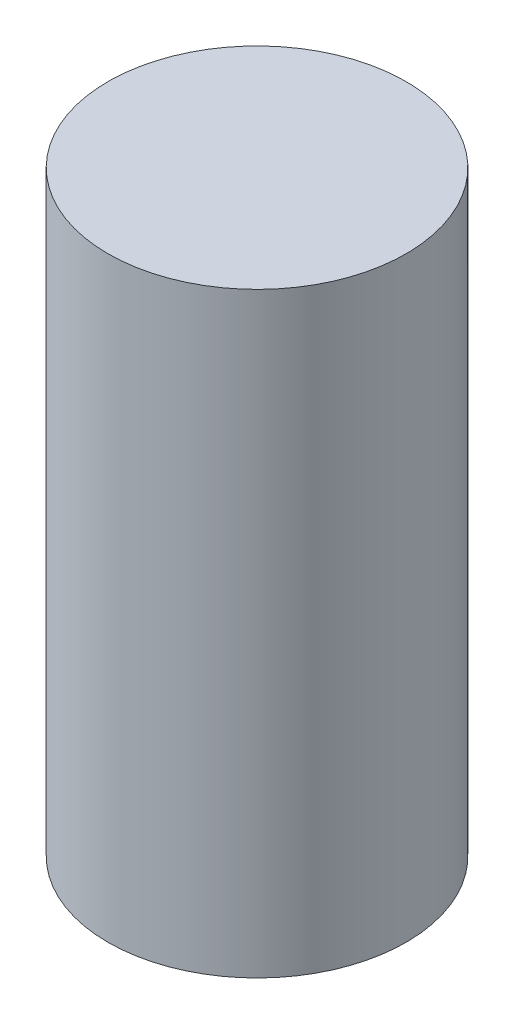
from build123d import *

# Parameters (mm, degrees)
SKETCH1_R           = 3.5
BOSS_EXTRUDE1_DEPTH = 14


with BuildPart() as part:
    # Sketch1 → Boss-Extrude1 (new body)
    with BuildSketch(Plane(origin=(0, 0, 0), x_dir=(1, 0, 0), z_dir=(0, 1, 0))):
        with Locations(Location((0, 0, 0), (0, 0, 270))):
            Circle(SKETCH1_R)
    extrude(amount=BOSS_EXTRUDE1_DEPTH)


solid = part.part
